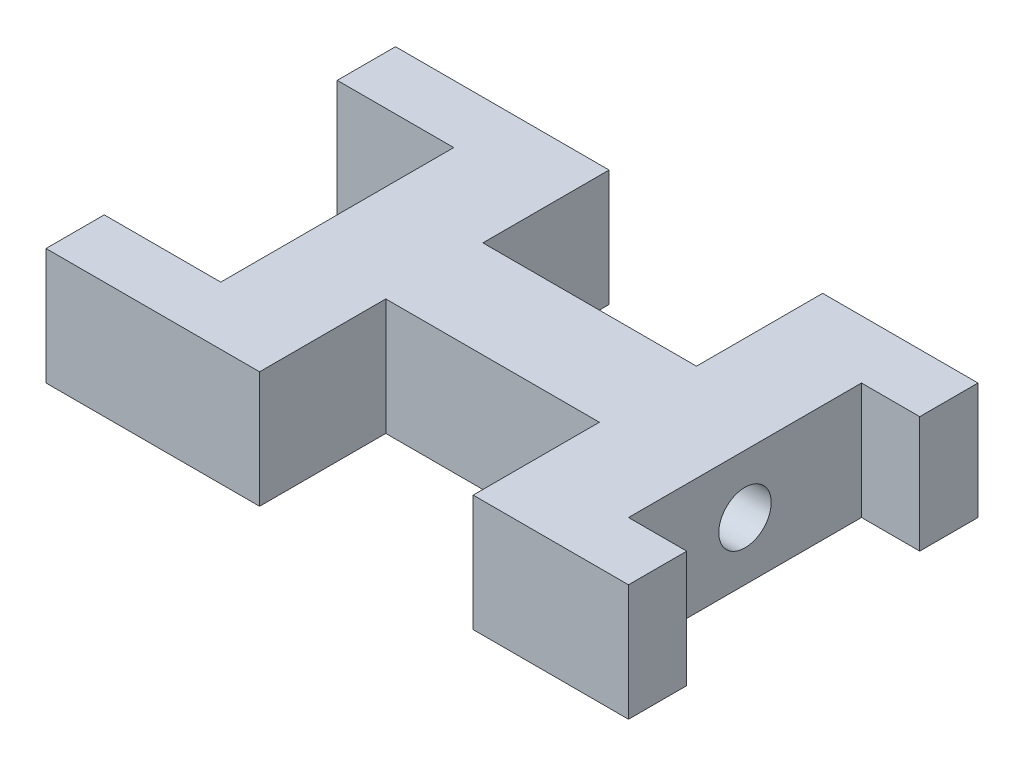
from build123d import *

# Parameters (mm, degrees)
BOSS_EXTRUDE1_DEPTH = 6
SKETCH2_R           = 1.35
CUT_EXTRUDE1_DEPTH  = 30.086079144


with BuildPart() as part:
    # Sketch1 → Boss-Extrude1 (new body)
    with BuildSketch(Plane(origin=(0, 0, 0), x_dir=(1, 0, 0), z_dir=(0, 1, 0))):
        Polygon((-5.5, 2.5), (-5.5, 9), (-16.5, 9), (-16.5, 6), (-10.5, 6), (-10.5, 1.847803827), (-10.5, 0), (-10.5, -6), (-16.5, -6), (-16.5, -9), (-5.5, -9), (-5.5, -2.5), (5.5, -2.5), (5.5, -9), (10.5, -9), (13.5, -9), (13.5, -6), (10.5, -6), (10.5, 0), (10.5, 6), (13.5, 6), (13.5, 9), (10.5, 9), (5.5, 9), (5.5, 2.5), align=None)
    extrude(amount=BOSS_EXTRUDE1_DEPTH)

    # Sketch2 → Cut-Extrude1 (cut, through all)
    with BuildSketch(Plane(origin=(10.5, 0, 0), x_dir=(0, 0, -1), z_dir=(1, 0, 0))):
        with Locations((0, 3)):
            Circle(SKETCH2_R)
    extrude(amount=-CUT_EXTRUDE1_DEPTH, mode=Mode.SUBTRACT)


solid = part.part
